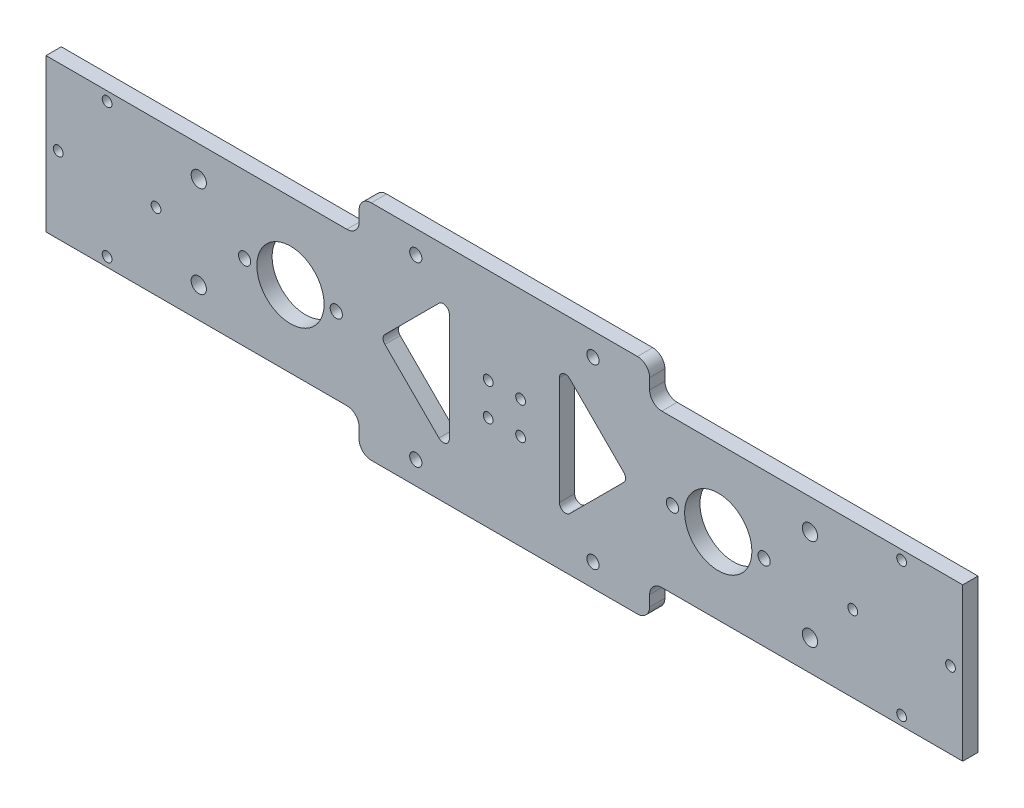
from build123d import *

# Parameters (mm, degrees)
SKETCH_1_R          = 2.1
SKETCH_1_R_2        = 1.6
SKETCH_1_R_3        = 11
SKETCH_1_R_4        = 2.5
EXTRUDE_1_DEPTH     = 5
SKETCH_2_R          = 3.689501017
SKETCH_2_R_2        = 3.294011366
EXTRUDE_2_DEPTH     = 5
CUT_EXTRUDE_1_REACH = 156.458
SKETCH_3_R          = 2
SKETCH_5_W          = 25.495020877
SKETCH_5_H          = 33.419148988
EXTRUDE_3_DEPTH     = 5
CUT_EXTRUDE_2_REACH = 156.458
SKETCH_4_R          = 2
FILLET_1_R          = 4
CUT_EXTRUDE_3_DEPTH = 10


with BuildPart() as part:
    # 草图1 → 凸台-拉伸1 (new body)
    with BuildSketch(Plane(origin=(0, 0, 0), x_dir=(-1, 0, 0), z_dir=(0, 0, -1))):
        with BuildLine():
            Line((-26.5, -36.5), (26.5, -36.5))
            ThreePointArc((26.5, -36.5), (31.295831523, -35.274964387), (34.916650165, -31.9))
            ThreePointArc((34.916650165, -31.9), (40.347878128, -26.837553419), (47.541625413, -25))
            Line((47.541625413, -25), (150, -25))
            Line((150, -25), (150, 25))
            Line((150, 25), (47.541625413, 25))
            ThreePointArc((47.541625413, 25), (40.347878128, 26.837553419), (34.916650165, 31.9))
            ThreePointArc((34.916650165, 31.9), (31.295831523, 35.274964387), (26.5, 36.5))
            Line((26.5, 36.5), (-26.5, 36.5))
            ThreePointArc((-26.5, 36.5), (-31.295831523, 35.274964387), (-34.916650165, 31.9))
            ThreePointArc((-34.916650165, 31.9), (-40.347878128, 26.837553419), (-47.541625413, 25))
            Line((-47.541625413, 25), (-150, 25))
            Line((-150, 25), (-150, -25))
            Line((-150, -25), (-47.541625413, -25))
            ThreePointArc((-47.541625413, -25), (-40.347878128, -26.837553419), (-34.916650165, -31.9))
            ThreePointArc((-34.916650165, -31.9), (-31.295831523, -35.274964387), (-26.5, -36.5))
        make_face()
        with Locations(Location((-29, 29, 0), (0, 0, 180))):
            Circle(SKETCH_1_R, mode=Mode.SUBTRACT)
        with Locations(Location((-29, -29, 0), (0, 0, 180))):
            Circle(SKETCH_1_R, mode=Mode.SUBTRACT)
        with Locations(Location((29, -29, 0), (0, 0, 180))):
            Circle(SKETCH_1_R, mode=Mode.SUBTRACT)
        with Locations(Location((29, 29, 0), (0, 0, 180))):
            Circle(SKETCH_1_R, mode=Mode.SUBTRACT)
        with Locations(Location((-54.5, 0, 0), (0, 0, 180))):
            Circle(SKETCH_1_R, mode=Mode.SUBTRACT)
        with Locations(Location((-114, 0, 0), (0, 0, 180))):
            Circle(SKETCH_1_R_2, mode=Mode.SUBTRACT)
        with Locations(Location((-5.303300859, 5.303300859, 0), (0, 0, 180))):
            Circle(SKETCH_1_R_2, mode=Mode.SUBTRACT)
        with Locations(Location((5.303300859, 5.303300859, 0), (0, 0, 180))):
            Circle(SKETCH_1_R_2, mode=Mode.SUBTRACT)
        with Locations(Location((70, 0, 0), (0, 0, 180))):
            Circle(SKETCH_1_R_3, mode=Mode.SUBTRACT)
        with Locations(Location((-85.5, 0, 0), (0, 0, 180))):
            Circle(SKETCH_1_R, mode=Mode.SUBTRACT)
        with Locations(Location((85.5, 0, 0), (0, 0, 180))):
            Circle(SKETCH_1_R, mode=Mode.SUBTRACT)
        with Locations(Location((54.5, 0, 0), (0, 0, 180))):
            Circle(SKETCH_1_R, mode=Mode.SUBTRACT)
        with Locations(Location((-70, 0, 0), (0, 0, 180))):
            Circle(SKETCH_1_R_3, mode=Mode.SUBTRACT)
        with Locations(Location((5.303300859, -5.303300859, 0), (0, 0, 180))):
            Circle(SKETCH_1_R_2, mode=Mode.SUBTRACT)
        with Locations(Location((-5.303300859, -5.303300859, 0), (0, 0, 180))):
            Circle(SKETCH_1_R_2, mode=Mode.SUBTRACT)
        with Locations(Location((114, 0, 0), (0, 0, 180))):
            Circle(SKETCH_1_R_2, mode=Mode.SUBTRACT)
        with Locations(Location((146, 0, 0), (0, 0, 180))):
            Circle(SKETCH_1_R_2, mode=Mode.SUBTRACT)
        with Locations(Location((130, 22, 0), (0, 0, 180))):
            Circle(SKETCH_1_R_2, mode=Mode.SUBTRACT)
        with Locations(Location((130, -22, 0), (0, 0, 180))):
            Circle(SKETCH_1_R_2, mode=Mode.SUBTRACT)
        with Locations(Location((-130, -22, 0), (0, 0, 180))):
            Circle(SKETCH_1_R_2, mode=Mode.SUBTRACT)
        with Locations(Location((-130, 22, 0), (0, 0, 180))):
            Circle(SKETCH_1_R_2, mode=Mode.SUBTRACT)
        with Locations(Location((-146, 0, 0), (0, 0, 180))):
            Circle(SKETCH_1_R_2, mode=Mode.SUBTRACT)
        with Locations(Location((100, 15, 0), (0, 0, 180))):
            Circle(SKETCH_1_R_4, mode=Mode.SUBTRACT)
        with Locations(Location((-100, 15, 0), (0, 0, 180))):
            Circle(SKETCH_1_R_4, mode=Mode.SUBTRACT)
        with Locations(Location((-100, -15, 0), (0, 0, 180))):
            Circle(SKETCH_1_R_4, mode=Mode.SUBTRACT)
        with Locations(Location((100, -15, 0), (0, 0, 180))):
            Circle(SKETCH_1_R_4, mode=Mode.SUBTRACT)
    extrude(amount=-EXTRUDE_1_DEPTH)

    # 草图2 → 凸台-拉伸2 (add)
    with BuildSketch(Plane.XY.offset(5)):
        with Locations((-85.5, 0)):
            Circle(SKETCH_2_R)
        with Locations((-54.5, 0)):
            Circle(SKETCH_2_R_2)
    extrude_2 = extrude(amount=-EXTRUDE_2_DEPTH)

    # 草图3 → 切除-拉伸1 (cut, up to next)
    with BuildSketch(Plane.XY.offset(5), mode=Mode.PRIVATE) as cut_extrude_1_sk1:
        with Locations((-85, 0)):
            Circle(SKETCH_3_R)
    cut_extrude_1_tool1 = extrude(cut_extrude_1_sk1.sketch, amount=-CUT_EXTRUDE_1_REACH, mode=Mode.PRIVATE) & part.part
    # 草图3 → 切除-拉伸1 (cut, up to next)
    with BuildSketch(Plane.XY.offset(5), mode=Mode.PRIVATE) as cut_extrude_1_sk2:
        with Locations((-55, 0)):
            Circle(SKETCH_3_R)
    cut_extrude_1_tool2 = extrude(cut_extrude_1_sk2.sketch, amount=-CUT_EXTRUDE_1_REACH, mode=Mode.PRIVATE) & part.part
    cut_extrude_1_1 = cut_extrude_1_tool1.solids().sort_by_distance((-85, 0, 5))[0]
    add(cut_extrude_1_1, mode=Mode.SUBTRACT)
    cut_extrude_1_2 = cut_extrude_1_tool2.solids().sort_by_distance((-55, 0, 5))[0]
    add(cut_extrude_1_2, mode=Mode.SUBTRACT)
    cut_extrude_1 = cut_extrude_1_1 + cut_extrude_1_2  # 切除-拉伸1 as one shape, for the pattern or mirror that repeats it

    # 镜向1: 凸台-拉伸2, 切除-拉伸1 across plane
    add(extrude_2.mirror(Plane.ZY))
    add(cut_extrude_1.mirror(Plane.ZY), mode=Mode.SUBTRACT)

    # 草图5 → 凸台-拉伸3 (add)
    with BuildSketch(Plane(origin=(0, 0, 0), x_dir=(-1, 0, 0), z_dir=(0, 0, -1))):
        Polygon((47.541625413, 25), (47.541625413, 36.5), (21.518894716, 36.5), (-47.541625413, 36.5), (-47.541625413, 25), (-47.541625413, -25), (-47.541625413, -36.5), (26.5, -36.5), (47.541625413, -36.5), (47.541625413, -25), align=None)
        with Locations((-1.313647453, -0.287111202)):
            Rectangle(SKETCH_5_W, SKETCH_5_H, mode=Mode.SUBTRACT)
    extrude(amount=-EXTRUDE_3_DEPTH)

    # 草图4 → 切除-拉伸2 (cut, up to next)
    with BuildSketch(Plane(origin=(0, 0, 0), x_dir=(-1, 0, 0), z_dir=(0, 0, -1)), mode=Mode.PRIVATE) as cut_extrude_2_sk1:
        with Locations((28.991378029, -28.991378029)):
            Circle(SKETCH_4_R)
    cut_extrude_2_tool1 = extrude(cut_extrude_2_sk1.sketch, amount=-CUT_EXTRUDE_2_REACH, mode=Mode.PRIVATE) & part.part
    # 草图4 → 切除-拉伸2 (cut, up to next)
    with BuildSketch(Plane(origin=(0, 0, 0), x_dir=(-1, 0, 0), z_dir=(0, 0, -1)), mode=Mode.PRIVATE) as cut_extrude_2_sk2:
        with Locations((-28.991378029, 28.991378029)):
            Circle(SKETCH_4_R)
    cut_extrude_2_tool2 = extrude(cut_extrude_2_sk2.sketch, amount=-CUT_EXTRUDE_2_REACH, mode=Mode.PRIVATE) & part.part
    # 草图4 → 切除-拉伸2 (cut, up to next)
    with BuildSketch(Plane(origin=(0, 0, 0), x_dir=(-1, 0, 0), z_dir=(0, 0, -1)), mode=Mode.PRIVATE) as cut_extrude_2_sk3:
        with Locations((28.991378029, 28.991378029)):
            Circle(SKETCH_4_R)
    cut_extrude_2_tool3 = extrude(cut_extrude_2_sk3.sketch, amount=-CUT_EXTRUDE_2_REACH, mode=Mode.PRIVATE) & part.part
    # 草图4 → 切除-拉伸2 (cut, up to next)
    with BuildSketch(Plane(origin=(0, 0, 0), x_dir=(-1, 0, 0), z_dir=(0, 0, -1)), mode=Mode.PRIVATE) as cut_extrude_2_sk4:
        with Locations((-28.991378029, -28.991378029)):
            Circle(SKETCH_4_R)
    cut_extrude_2_tool4 = extrude(cut_extrude_2_sk4.sketch, amount=-CUT_EXTRUDE_2_REACH, mode=Mode.PRIVATE) & part.part
    add(cut_extrude_2_tool1.solids().sort_by_distance((-28.991378, -28.991378, 0))[0], mode=Mode.SUBTRACT)
    add(cut_extrude_2_tool2.solids().sort_by_distance((28.991378, 28.991378, 0))[0], mode=Mode.SUBTRACT)
    add(cut_extrude_2_tool3.solids().sort_by_distance((-28.991378, 28.991378, 0))[0], mode=Mode.SUBTRACT)
    add(cut_extrude_2_tool4.solids().sort_by_distance((28.991378, -28.991378, 0))[0], mode=Mode.SUBTRACT)

    # 圆角1
    fillet_1_edges = [part.edges().sort_by_distance(p)[0] for p in [
        (-47.541625413, 36.5, 2.5),
        (47.541625413, -36.5, 2.5),
        (47.541625413, -25, 2.5),
        (47.541625413, 25, 2.5),
        (-47.541625413, 25, 2.5),
        (-47.541625413, -36.5, 2.5),
        (47.541625413, 36.5, 2.5),
        (-47.541625413, -25, 2.5),
    ]]
    fillet(fillet_1_edges, radius=FILLET_1_R)

    # 草图6 → 切除-拉伸3 (cut)
    with BuildSketch(Plane(origin=(0, 0, 0), x_dir=(-1, 0, 0), z_dir=(0, 0, -1))):
        with BuildLine():
            Line((-21.414213562, 19.085786438), (-39.085786438, 1.414213562))
            ThreePointArc((-39.085786438, 1.414213562), (-39.671572875, 0), (-39.085786438, -1.414213562))
            Line((-39.085786438, -1.414213562), (-21.414213562, -19.085786438))
            ThreePointArc((-21.414213562, -19.085786438), (-19.234633135, -19.51933194), (-18, -17.671572875))
            Line((-18, -17.671572875), (-18, 17.671572875))
            ThreePointArc((-18, 17.671572875), (-19.234633135, 19.51933194), (-21.414213562, 19.085786438))
        make_face()
        with BuildLine():
            Line((18, -17.671572875), (18, 17.671572875))
            ThreePointArc((18, 17.671572875), (19.234633135, 19.51933194), (21.414213562, 19.085786438))
            Line((21.414213562, 19.085786438), (39.085786438, 1.414213562))
            ThreePointArc((39.085786438, 1.414213562), (39.671572875, 0), (39.085786438, -1.414213562))
            Line((39.085786438, -1.414213562), (21.414213562, -19.085786438))
            ThreePointArc((21.414213562, -19.085786438), (19.234633135, -19.51933194), (18, -17.671572875))
        make_face()
    extrude(amount=-CUT_EXTRUDE_3_DEPTH, mode=Mode.SUBTRACT)


solid = part.part
